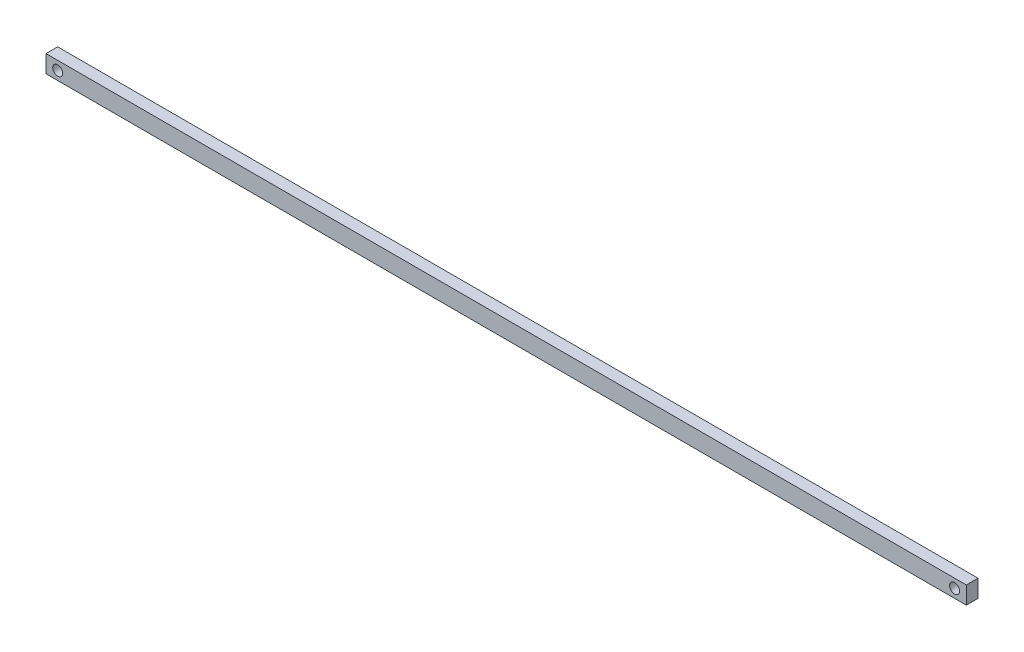
from build123d import *

# Parameters (mm, degrees)
SKETCH1_W           = 788
SKETCH1_H           = 15
BOSS_EXTRUDE1_DEPTH = 10
SKETCH2_R           = 4.255
CUT_EXTRUDE1_DEPTH  = 10


with BuildPart() as part:
    # Sketch1 → Boss-Extrude1 (new body)
    with BuildSketch(Plane.XY):
        with Locations((394, 7.5)):
            Rectangle(SKETCH1_W, SKETCH1_H)
    extrude(amount=BOSS_EXTRUDE1_DEPTH)

    # Sketch2 → Cut-Extrude1 (cut)
    with BuildSketch(Plane.XY.offset(10)):
        with Locations((10, 7.5)):
            Circle(SKETCH2_R)
        with Locations((778, 7.5)):
            Circle(SKETCH2_R)
    extrude(amount=-CUT_EXTRUDE1_DEPTH, mode=Mode.SUBTRACT)


solid = part.part
